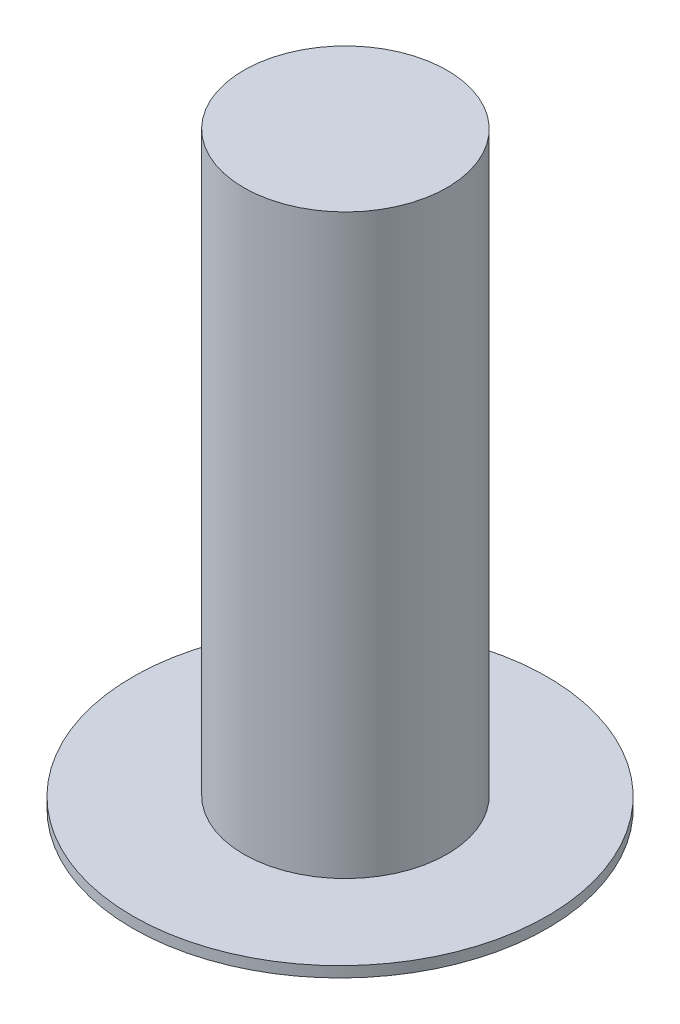
from build123d import *

# Parameters (mm, degrees)
SKETCH2_R           = 13.040317797
SKETCH2_R_2         = 5.518298306
BOSS_EXTRUDE2_DEPTH = 0.671461598
SKETCH6_R           = 6.398635868
BOSS_EXTRUDE7_DEPTH = 36.322


with BuildPart() as part:
    # Sketch2 → Boss-Extrude2 (new body)
    with BuildSketch(Plane(origin=(0, 0, 0), x_dir=(1, 0, 0), z_dir=(0, 1, 0))):
        with Locations(Location((-128.852862379, 15.600638677, 0), (0, 0, 270))):
            Circle(SKETCH2_R)
        with Locations(Location((-128.852862379, 15.600638677, 0), (0, 0, 270))):
            Circle(SKETCH2_R_2, mode=Mode.SUBTRACT)
    extrude(amount=BOSS_EXTRUDE2_DEPTH)

    # Sketch6 → Boss-Extrude7 (add)
    with BuildSketch(Plane(origin=(0, 0.671461598, 0), x_dir=(1, 0, 0), z_dir=(0, 1, 0))):
        with Locations(Location((-128.733807545, 15.818905873, 0), (0, 0, 270))):
            Circle(SKETCH6_R)
    extrude(amount=BOSS_EXTRUDE7_DEPTH)


solid = part.part
